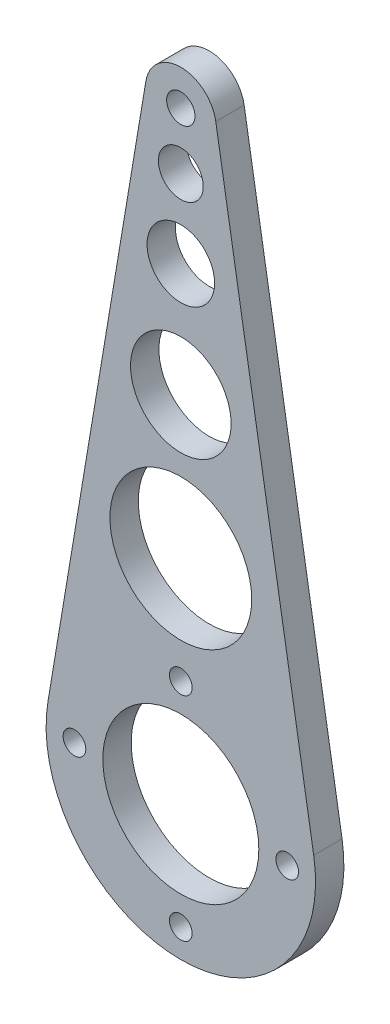
from build123d import *

# Parameters (mm, degrees)
ESQUISSE1_R        = 1.6
ESQUISSE1_R_2      = 11
ESQUISSE1_R_3      = 2
ESQUISSE1_R_4      = 3.163636364
ESQUISSE1_R_5      = 10
ESQUISSE1_R_6      = 7.090909091
ESQUISSE1_R_7      = 4.763636364
BOSS_EXTRU_1_DEPTH = 4


with BuildPart() as part:
    # Esquisse1 → Boss.-Extru.1 (new body)
    with BuildSketch(Plane.XY):
        with BuildLine():
            Line((-18.740511786, 3.129411765), (-4.931713628, 85.823529412))
            ThreePointArc((-4.931713628, 85.823529412), (0, 90), (4.931713628, 85.823529412))
            Line((4.931713628, 85.823529412), (18.740511786, 3.129411765))
            ThreePointArc((18.740511786, 3.129411765), (0, -19), (-18.740511786, 3.129411765))
        make_face()
        with Locations((0, 15)):
            Circle(ESQUISSE1_R, mode=Mode.SUBTRACT)
        with Locations((15, 0)):
            Circle(ESQUISSE1_R, mode=Mode.SUBTRACT)
        with Locations((0, -15)):
            Circle(ESQUISSE1_R, mode=Mode.SUBTRACT)
        with Locations((-15, 0)):
            Circle(ESQUISSE1_R, mode=Mode.SUBTRACT)
        Circle(ESQUISSE1_R_2, mode=Mode.SUBTRACT)
        with Locations((0, 85)):
            Circle(ESQUISSE1_R_3, mode=Mode.SUBTRACT)
        with Locations((0, 77)):
            Circle(ESQUISSE1_R_4, mode=Mode.SUBTRACT)
        with Locations((0, 30)):
            Circle(ESQUISSE1_R_5, mode=Mode.SUBTRACT)
        with Locations((0, 50)):
            Circle(ESQUISSE1_R_6, mode=Mode.SUBTRACT)
        with Locations((0, 66)):
            Circle(ESQUISSE1_R_7, mode=Mode.SUBTRACT)
    extrude(amount=BOSS_EXTRU_1_DEPTH)


solid = part.part
